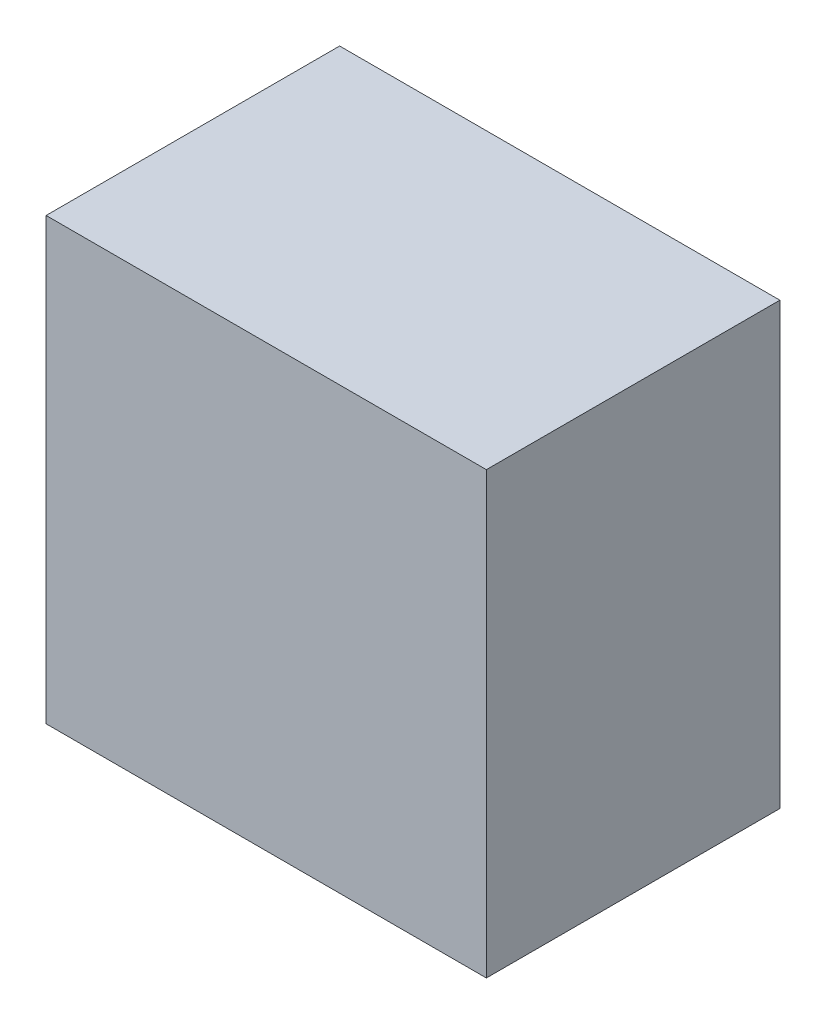
from build123d import *

# Parameters (mm, degrees)
SKETCH1_W           = 38.1
SKETCH1_H           = 38.1
BOSS_EXTRUDE1_DEPTH = 25.4


with BuildPart() as part:
    # Sketch1 → Boss-Extrude1 (new body)
    with BuildSketch(Plane.XY):
        with Locations((19.05, -19.05)):
            Rectangle(SKETCH1_W, SKETCH1_H)
    extrude(amount=BOSS_EXTRUDE1_DEPTH)


solid = part.part
